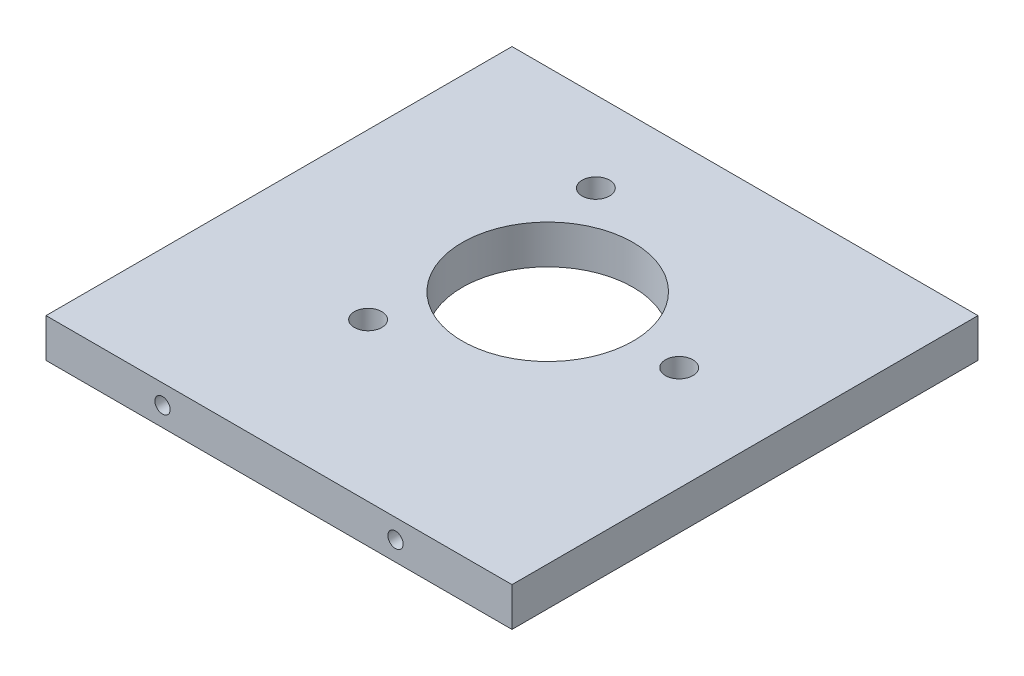
from build123d import *

# Parameters (mm, degrees)
BOSS_EXTRUDE1_DEPTH                             = 76.2
BOSS_EXTRUDE1_DEPTH_BACK                        = 76.2
SKETCH3_W                                       = 76.2
SKETCH3_H                                       = 6.35
SKETCH11_R                                      = 13.97
CUT_EXTRUDE1_DEPTH                              = 86.430512699
CSK_FOR_M4_FLAT_HEAD_MACHINE_SCREW1_D           = 4.5
CSK_FOR_M4_FLAT_HEAD_MACHINE_SCREW1_CSINK_D     = 9.4
CSK_FOR_M4_FLAT_HEAD_MACHINE_SCREW1_CSINK_ANGLE = 90
SKETCH20_W                                      = 76.2
SKETCH20_H                                      = 76.2
CUT_EXTRUDE2_DEPTH                              = 86.430512699
M3X0_5_TAPPED_HOLE3_D                           = 2.5
M3X0_5_TAPPED_HOLE3_DEPTH                       = 11.948924226
M3X0_5_TAPPED_HOLE3_TIP                         = 0.751075774


with BuildPart() as part:
    # Sketch3 → Boss-Extrude1 (new, two sides: drawn at the far end of the back side and taken through both)
    with BuildSketch(Plane.XY.offset(-BOSS_EXTRUDE1_DEPTH_BACK)):
        Rectangle(SKETCH3_W, SKETCH3_H)
    extrude(amount=BOSS_EXTRUDE1_DEPTH + BOSS_EXTRUDE1_DEPTH_BACK)

    # Sketch11 → Cut-Extrude1 (cut, through all)
    with BuildSketch(Plane.XZ.offset(3.175)):
        with Locations(Location((-0.450951641, 31.810066373, 0), (0, 0, 270))):
            Circle(SKETCH11_R)
    extrude(amount=-CUT_EXTRUDE1_DEPTH, mode=Mode.SUBTRACT)

    # CSK for M4 Flat Head Machine Screw1 (through all)
    with Locations(Plane(origin=(0, -3.175, 0), x_dir=(-1, 0, 0), z_dir=(0, -1, 0))):
        with Locations((11.200951641, -13.190520192), (-21.049048359, -31.810066373), (11.200951641, -50.429612554)):
            CounterSinkHole(CSK_FOR_M4_FLAT_HEAD_MACHINE_SCREW1_D / 2, CSK_FOR_M4_FLAT_HEAD_MACHINE_SCREW1_CSINK_D / 2, counter_sink_angle=CSK_FOR_M4_FLAT_HEAD_MACHINE_SCREW1_CSINK_ANGLE)

    # Sketch20 → Cut-Extrude2 (cut, through all)
    with BuildSketch(Plane.XZ.offset(3.175)):
        with Locations((0, -38.1)):
            Rectangle(SKETCH20_W, SKETCH20_H)
    extrude(amount=-CUT_EXTRUDE2_DEPTH, mode=Mode.SUBTRACT)

    # M3x0.5 Tapped Hole3
    with Locations(Plane.XY.offset(76.2)):
        with Locations((19.05, 0), (-19.05, 0)):
            Hole(M3X0_5_TAPPED_HOLE3_D / 2, depth=M3X0_5_TAPPED_HOLE3_DEPTH)
            with Locations((0, 0, -(M3X0_5_TAPPED_HOLE3_DEPTH + M3X0_5_TAPPED_HOLE3_TIP / 2))):  # 118° drill point
                Cone(0, M3X0_5_TAPPED_HOLE3_D / 2, M3X0_5_TAPPED_HOLE3_TIP, mode=Mode.SUBTRACT)


solid = part.part
